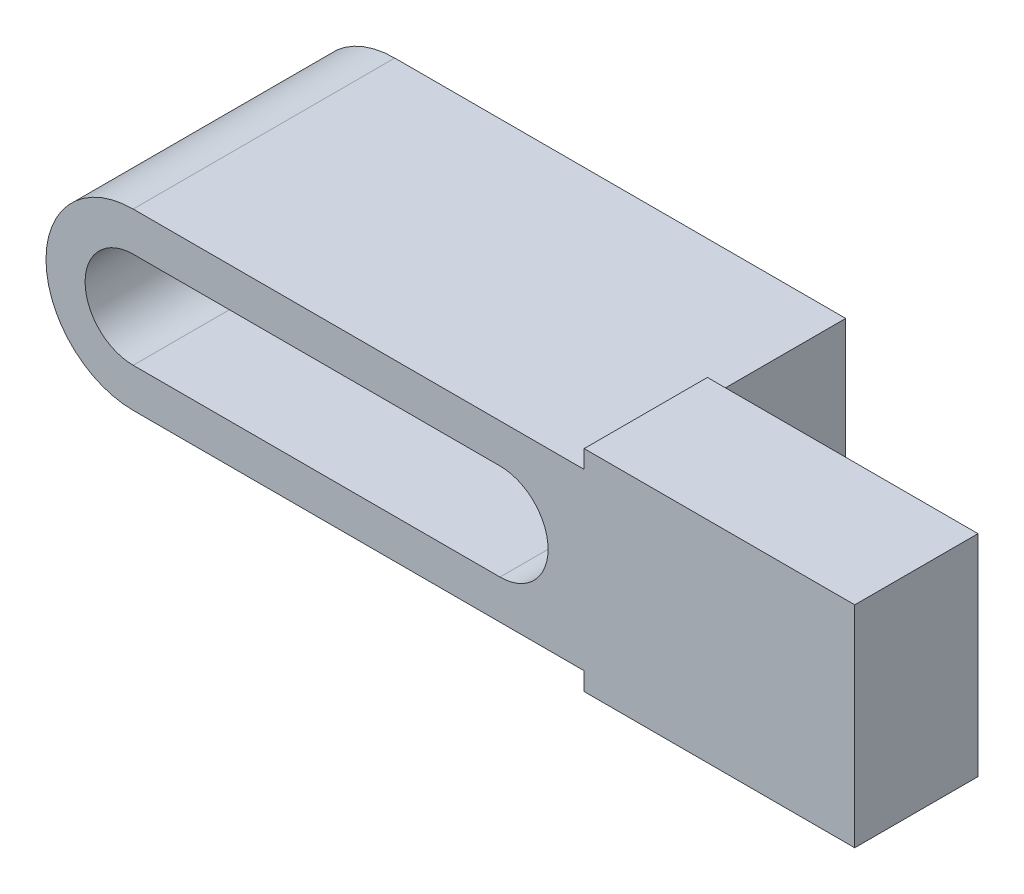
from build123d import *

# Parameters (mm, degrees)
EXTRUDE_1_DEPTH     = 4.6
EXTRUDE_2_DEPTH     = 4.1
CUT_EXTRUDE_1_DEPTH = 26.767033201


with BuildPart() as part:
    # Эскиз1 → Бобышка-Вытянуть1 (new body)
    with BuildSketch(Plane.XY):
        with BuildLine():
            Line((0, 2.9), (15, 2.9))
            Line((15, 2.9), (15, -2.9))
            Line((15, -2.9), (0, -2.9))
            ThreePointArc((0, -2.9), (-2.9, 0), (0, 2.9))
        make_face()
    extrude(amount=EXTRUDE_1_DEPTH)

    # Эскиз2 → Бобышка-Вытянуть2 (add)
    with BuildSketch(Plane.XY.offset(4.6)):
        with BuildLine():
            Line((24, 3.5), (24, -3.5))
            Line((24, -3.5), (15, -3.5))
            Line((15, -3.5), (15, -2.9))
            Line((15, -2.9), (0, -2.9))
            ThreePointArc((0, -2.9), (-2.9, 0), (0, 2.9))
            Line((0, 2.9), (15, 2.9))
            Line((15, 2.9), (15, 3.5))
            Line((15, 3.5), (24, 3.5))
        make_face()
    extrude(amount=EXTRUDE_2_DEPTH)

    # Эскиз3 → Вырез-Вытянуть1 (cut, through all)
    with BuildSketch(Plane.XY.offset(8.7)):
        with BuildLine():
            Line((0, 1.6), (12.2, 1.6))
            ThreePointArc((12.2, 1.6), (13.8, 0), (12.2, -1.6))
            Line((12.2, -1.6), (0, -1.6))
            ThreePointArc((0, -1.6), (-1.6, 0), (0, 1.6))
        make_face()
    extrude(amount=-CUT_EXTRUDE_1_DEPTH, mode=Mode.SUBTRACT)


solid = part.part
